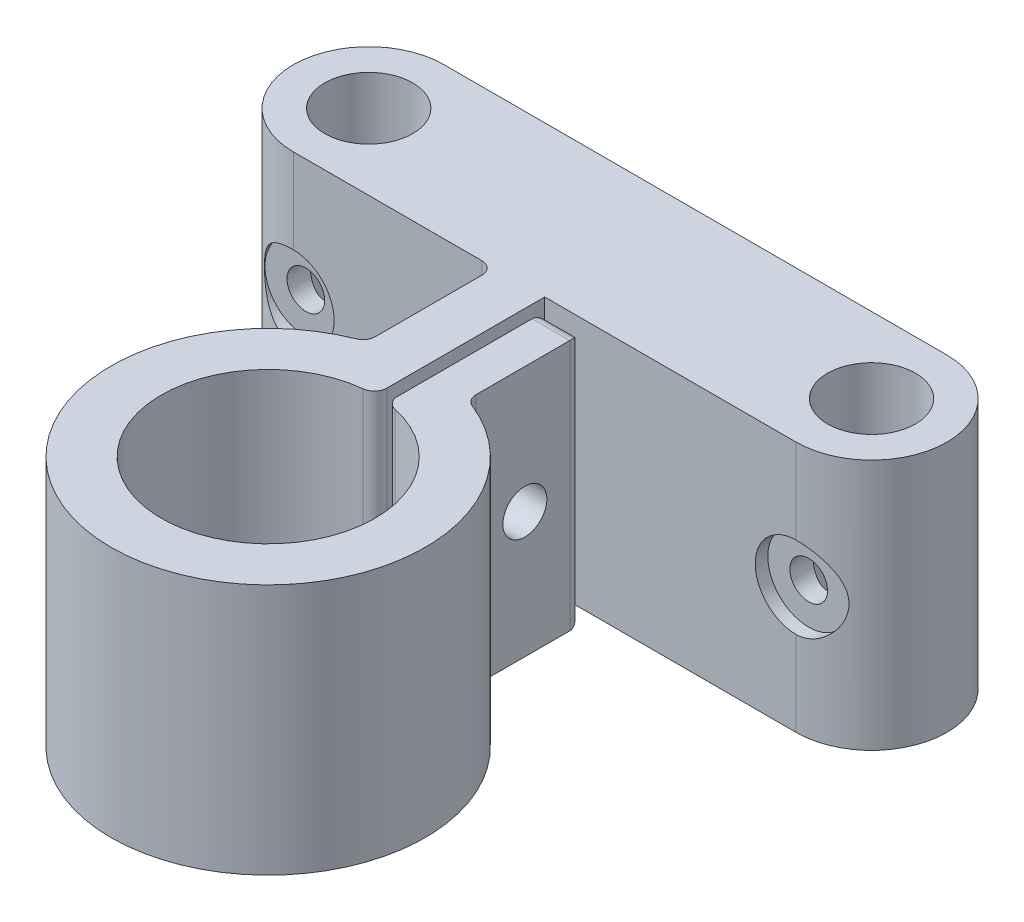
from build123d import *

# Parameters (mm, degrees)
SALIENTE_EXTRUIR1_DEPTH    = 20
CROQUIS2_R                 = 3.5
CORTAR_EXTRUIR1_DEPTH      = 34.346664001
CORTAR_EXTRUIR2_DEPTH      = 34.346664001
CORTAR_EXTRUIR2_DEPTH_BACK = 34.346664001
CROQUIS3_R                 = 1.5
CROQUIS4_R                 = 3.25
CORTAR_EXTRUIR3_DEPTH      = 1
SALIENTE_EXTRUIR2_DEPTH    = 20
CORTAR_EXTRUIR4_DEPTH      = 53.117655446
CORTAR_EXTRUIR4_DEPTH_BACK = 53.117655446
CROQUIS7_R                 = 1.75
CORTAR_EXTRUIR5_DEPTH      = 2
REDONDEO1_R                = 1


with BuildPart() as part:
    # Croquis1 → Saliente-Extruir1 (new body)
    with BuildSketch(Plane(origin=(0, 0, 0), x_dir=(1, 0, 0), z_dir=(0, 1, 0))):
        with BuildLine():
            Line((-20, 6), (20, 6))
            ThreePointArc((20, 6), (26, 0), (20, -6))
            Line((20, -6), (-20, -6))
            ThreePointArc((-20, -6), (-26, 0), (-20, 6))
        make_face()
    extrude(amount=SALIENTE_EXTRUIR1_DEPTH)

    # Croquis2 → Cortar-Extruir1 (cut, through all)
    with BuildSketch(Plane(origin=(0, 0, 0), x_dir=(1, 0, 0), z_dir=(0, 1, 0))):
        with Locations(Location((-20, 0, 0), (0, 0, 270))):
            Circle(CROQUIS2_R)
        with Locations(Location((20, 0, 0), (0, 0, 270))):
            Circle(CROQUIS2_R)
    extrude(amount=CORTAR_EXTRUIR1_DEPTH, mode=Mode.SUBTRACT)

    # Croquis3 → Cortar-Extruir2 (cut, two sides: drawn at the far end of the back side and taken through both)
    with BuildSketch(Plane.XY.offset(-CORTAR_EXTRUIR2_DEPTH_BACK)):
        with Locations(Location((-20, 10, 0), (0, 0, 270))):
            Circle(CROQUIS3_R)
        with Locations(Location((20, 10, 0), (0, 0, 270))):
            Circle(CROQUIS3_R)
    extrude(amount=CORTAR_EXTRUIR2_DEPTH + CORTAR_EXTRUIR2_DEPTH_BACK, mode=Mode.SUBTRACT)

    # Croquis4 → Cortar-Extruir3 (cut)
    with BuildSketch(Plane.XY.offset(6)):
        with Locations((-20, 10)):
            Circle(CROQUIS4_R)
        with Locations(Location((20, 10, 0), (0, 0, 270.000000001))):
            Circle(CROQUIS4_R)
    extrude(amount=-CORTAR_EXTRUIR3_DEPTH, mode=Mode.SUBTRACT)

    # Croquis6 → Saliente-Extruir2 (add)
    with BuildSketch(Plane.XZ):
        with BuildLine():
            Line((-4, 6), (-4, 16.157280718))
            ThreePointArc((-4, 16.157280718), (0, 40.5), (4, 16.157280718))
            Line((4, 16.157280718), (4, 7))
            Line((4, 7), (1, 7))
            Line((1, 7), (1, 19.559028492))
            ThreePointArc((1, 19.559028492), (-0.500870333, 36.485230045), (0, 19.5))
            Line((0, 19.5), (0, 6))
            Line((0, 6), (-4, 6))
        make_face()
    extrude(amount=-SALIENTE_EXTRUIR2_DEPTH)

    # Croquis7 → Cortar-Extruir4 (cut, two sides: drawn at the far end of the back side and taken through both)
    with BuildSketch(Plane(origin=(0, 0, 0), x_dir=(0, 0, -1), z_dir=(1, 0, 0)).offset(-CORTAR_EXTRUIR4_DEPTH_BACK)):
        with Locations((-11.578640359, 10)):
            Circle(CROQUIS7_R)
    extrude(amount=CORTAR_EXTRUIR4_DEPTH + CORTAR_EXTRUIR4_DEPTH_BACK, mode=Mode.SUBTRACT)

    # Croquis8 → Cortar-Extruir5 (cut)
    with BuildSketch(Plane.ZY.offset(4)):
        Polygon((11.578640359, 13.75277675), (8.328640359, 11.876388375), (8.328640359, 8.123611625), (11.578640359, 6.24722325), (14.828640359, 8.123611625), (14.828640359, 11.876388375), align=None)
    extrude(amount=-CORTAR_EXTRUIR5_DEPTH, mode=Mode.SUBTRACT)

    # Redondeo1
    redondeo1_edges = [part.edges().sort_by_distance(p)[0] for p in [
        (0, 10, 19.5),
        (-4, 10, 6),
        (-4, 10, 16.157280718),
        (4, 10, 16.157280718),
        (4, 10, 7),
        (1, 10, 7),
        (1, 10, 19.559028492),
        (2.5, 0, 7),
        (2.5, 20, 7),
    ]]
    fillet(redondeo1_edges, radius=REDONDEO1_R)


solid = part.part
